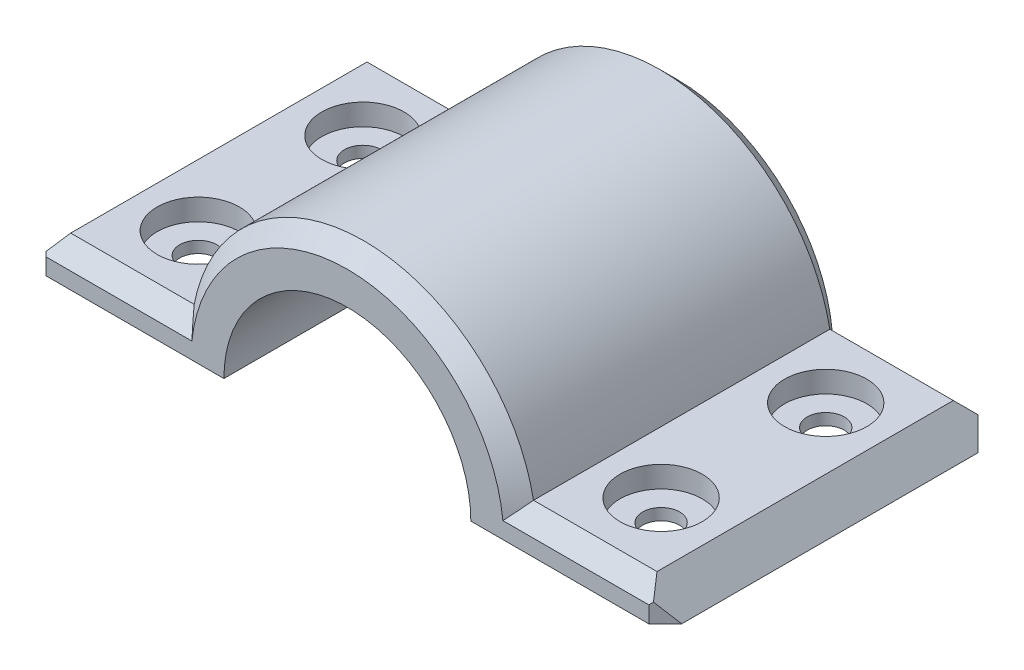
from build123d import *

# Parameters (mm, degrees)
ESTRUSIONE_ESTRUSIONE1_DEPTH                         = 40
FORO_LAMATO_PER_VITE_M4_A_TESTA_CILINDRI_D           = 4.5
FORO_LAMATO_PER_VITE_M4_A_TESTA_CILINDRI_DEPTH       = 80
FORO_LAMATO_PER_VITE_M4_A_TESTA_CILINDRI_CBORE_D     = 10
FORO_LAMATO_PER_VITE_M4_A_TESTA_CILINDRI_CBORE_DEPTH = 2.6
FORO_LAMATO_PER_VITE_M4_A_TESTA_CILINDRI_TIP         = 1.351936393
SMUSSO1_SIZE                                         = 2
TAGLIO_ESTRUSIONE1_DEPTH                             = 10


with BuildPart() as part:
    # Schizzo1 → Estrusione-Estrusione1 (new body)
    with BuildSketch(Plane.XY):
        with BuildLine():
            Line((-15, 0), (-38.615528128, 0))
            Line((-38.615528128, 0), (-35.615528128, 4))
            Line((-35.615528128, 4), (-20.615528128, 4))
            ThreePointArc((-20.615528128, 4), (0, 21), (20.615528128, 4))
            Line((20.615528128, 4), (35.615528128, 4))
            Line((35.615528128, 4), (38.615528128, 0))
            Line((38.615528128, 0), (15, 0))
            ThreePointArc((15, 0), (0, 15), (-15, 0))
        make_face()
    extrude(amount=ESTRUSIONE_ESTRUSIONE1_DEPTH)

    # Foro lamato per Vite M4 a testa cilindrica-1
    with Locations(Plane(origin=(0, 4, 0), x_dir=(1, 0, 0), z_dir=(0, 1, 0))):
        with Locations((-28.115528128, -10), (-28.115528128, -30), (28.115528128, -30), (28.115528128, -10)):
            CounterBoreHole(FORO_LAMATO_PER_VITE_M4_A_TESTA_CILINDRI_D / 2, FORO_LAMATO_PER_VITE_M4_A_TESTA_CILINDRI_CBORE_D / 2, FORO_LAMATO_PER_VITE_M4_A_TESTA_CILINDRI_CBORE_DEPTH, depth=FORO_LAMATO_PER_VITE_M4_A_TESTA_CILINDRI_DEPTH)
            with Locations((0, 0, -(FORO_LAMATO_PER_VITE_M4_A_TESTA_CILINDRI_DEPTH + FORO_LAMATO_PER_VITE_M4_A_TESTA_CILINDRI_TIP / 2))):  # 118° drill point
                Cone(0, FORO_LAMATO_PER_VITE_M4_A_TESTA_CILINDRI_D / 2, FORO_LAMATO_PER_VITE_M4_A_TESTA_CILINDRI_TIP, mode=Mode.SUBTRACT)

    # Smusso1
    smusso1_edges = [part.edges().sort_by_distance(p)[0] for p in [
        (28.115528128, 4, 0),
        (28.115528128, 4, 40),
        (0, 21, 40),
        (-28.115528128, 4, 40),
        (-28.115528128, 4, 0),
        (0, 21, 0),
    ]]
    chamfer(smusso1_edges, length=SMUSSO1_SIZE)

    # Schizzo4 → Taglio-Estrusione1 (cut)
    with BuildSketch(Plane.XZ):
        Polygon((-38.615528128, 38), (-36.615528128, 40), (-38.615528128, 40), align=None)
        Polygon((-38.615528128, 2), (-36.615528128, 0), (-38.615528128, 0), align=None)
        Polygon((36.615528128, 0), (38.615528128, 2), (38.615528128, 0), align=None)
        Polygon((36.615528128, 40), (38.615528128, 40), (38.615528128, 38), align=None)
    extrude(amount=-TAGLIO_ESTRUSIONE1_DEPTH, mode=Mode.SUBTRACT)


solid = part.part
